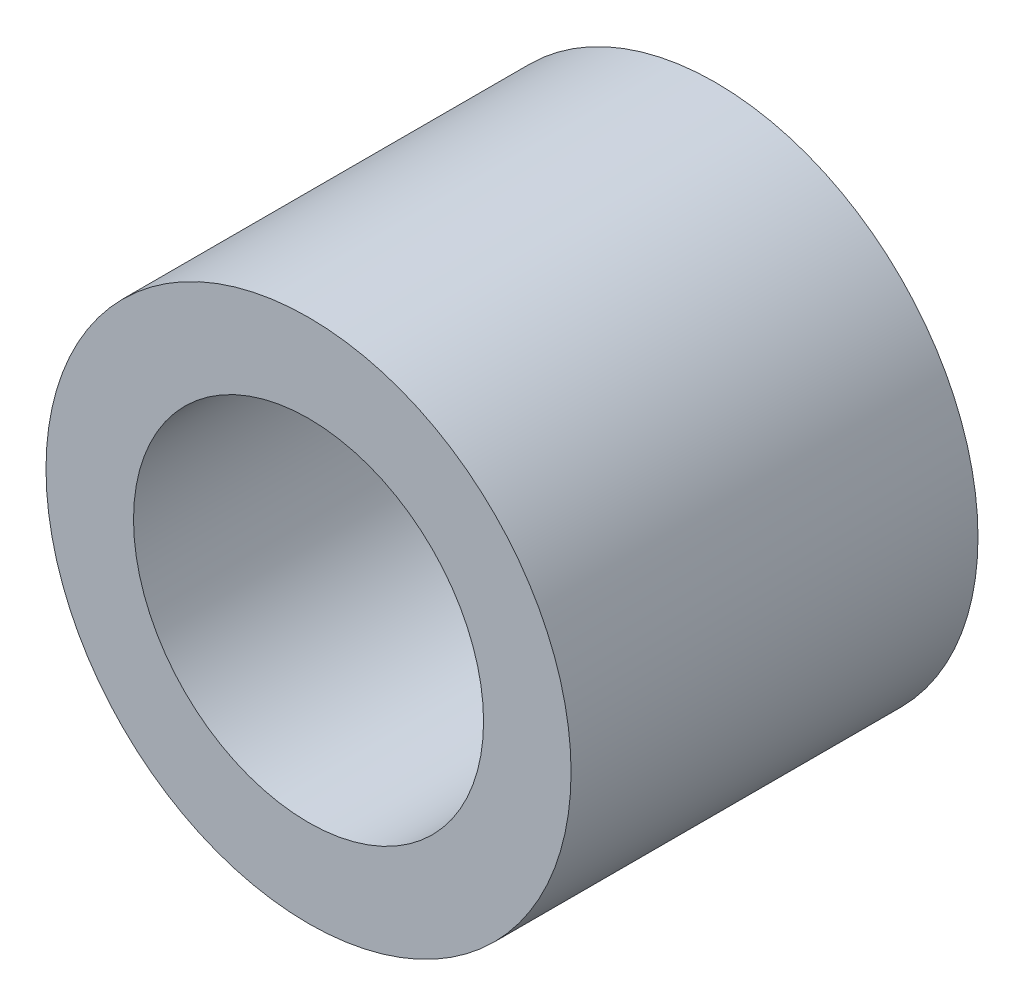
from build123d import *

# Parameters (mm, degrees)
SZKIC1_R                    = 9
SZKIC1_R_2                  = 6
DODANIE_WYCI_GNI_CIE1_DEPTH = 13.95


with BuildPart() as part:
    # Szkic1 → Dodanie-wyciągnięcie1 (new body)
    with BuildSketch(Plane.XY):
        Circle(SZKIC1_R)
        Circle(SZKIC1_R_2, mode=Mode.SUBTRACT)
    extrude(amount=DODANIE_WYCI_GNI_CIE1_DEPTH)


solid = part.part
